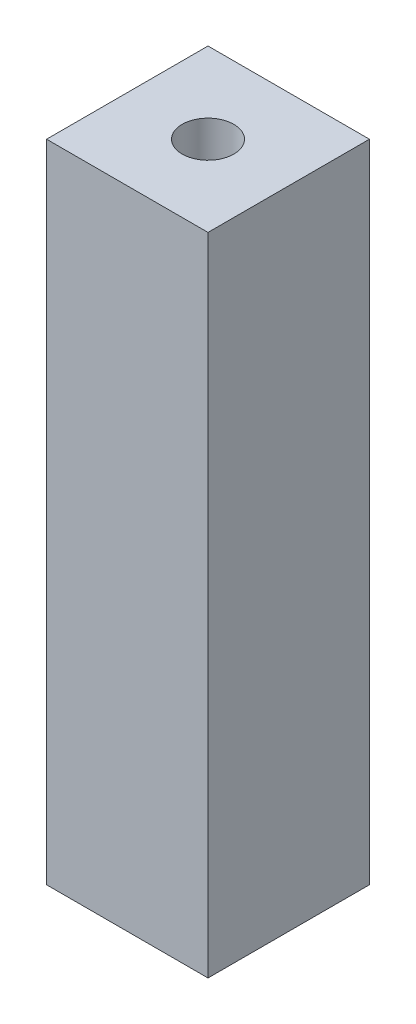
from build123d import *

# Parameters (mm, degrees)
SKETCH_1_W      = 10
SKETCH_1_H      = 10
SKETCH_1_R      = 1.6
EXTRUDE_1_DEPTH = 40


with BuildPart() as part:
    # 草图1 → 凸台-拉伸1 (new body)
    with BuildSketch(Plane(origin=(0, 0, 0), x_dir=(1, 0, 0), z_dir=(0, 1, 0))):
        Rectangle(SKETCH_1_W, SKETCH_1_H)
        with Locations(Location((0, 0, 0), (0, 0, 270))):
            Circle(SKETCH_1_R, mode=Mode.SUBTRACT)
    extrude(amount=EXTRUDE_1_DEPTH)


solid = part.part
